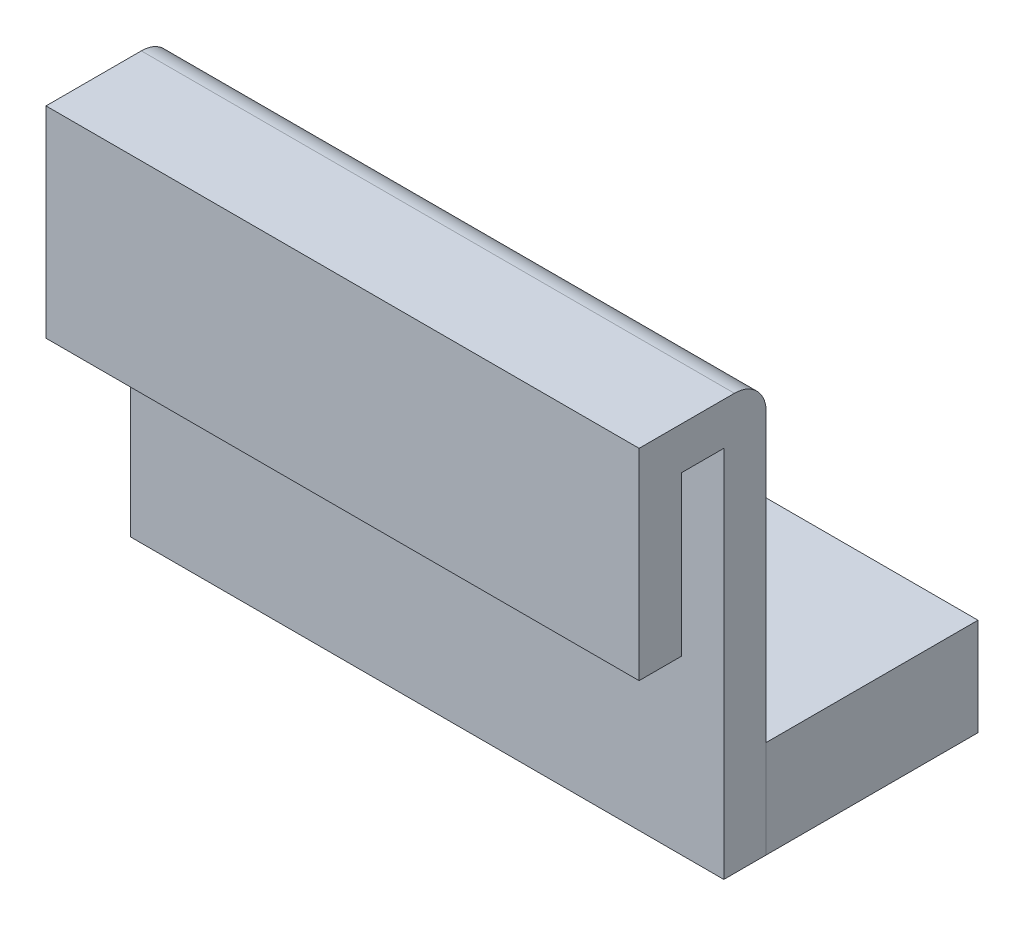
from build123d import *

# Parameters (mm, degrees)
SKETCH1_W               = 560
SKETCH1_H               = 92
BOSS_EXTRUDE1_DEPTH     = 200
SKETCH2_W               = 560
SKETCH2_H               = 352.56
BOSS_EXTRUDE2_DEPTH     = 40
CUT_EXTRUDE1_DEPTH      = 480.56129285
CUT_EXTRUDE1_DEPTH_BACK = 5
SKETCH3_R               = 15
SKETCH4_W               = 560
SKETCH4_H               = 40
BOSS_EXTRUDE3_DEPTH     = 40
SKETCH5_W               = 560
SKETCH5_H               = 40
BOSS_EXTRUDE4_DEPTH     = 40
FILLET1_R               = 30
SKETCH6_W               = 560
SKETCH6_H               = 40
BOSS_EXTRUDE5_DEPTH     = 40
SKETCH7_W               = 560
SKETCH7_H               = 40
BOSS_EXTRUDE6_DEPTH     = 150


with BuildPart() as part:
    # Sketch1 → Boss-Extrude1 (new body)
    with BuildSketch(Plane.XY):
        Rectangle(SKETCH1_W, SKETCH1_H)
    extrude(amount=BOSS_EXTRUDE1_DEPTH)

    # Sketch3 → Cut-Extrude1 (cut, two sides: drawn at the far end of the back side and taken through both)
    with BuildSketch(Plane(origin=(0, 0, 0), x_dir=(-1, 0, 0), z_dir=(0, 0, -1)).offset(-CUT_EXTRUDE1_DEPTH_BACK)):
        with Locations(Location((0, 0, 0), (0, 0, 180))):
            Circle(SKETCH3_R)
    extrude(amount=CUT_EXTRUDE1_DEPTH + CUT_EXTRUDE1_DEPTH_BACK, mode=Mode.SUBTRACT)


with BuildPart() as body_2:
    # Sketch2 → Boss-Extrude2 (new body)
    with BuildSketch(Plane.XY.offset(200)):
        with Locations((0, 130.28)):
            Rectangle(SKETCH2_W, SKETCH2_H)
    extrude(amount=BOSS_EXTRUDE2_DEPTH)

    # Sketch4 → Boss-Extrude3 (add)
    with BuildSketch(Plane(origin=(0, 306.56, 0), x_dir=(1, 0, 0), z_dir=(0, 1, 0))):
        with Locations((0, -220)):
            Rectangle(SKETCH4_W, SKETCH4_H)
    extrude(amount=BOSS_EXTRUDE3_DEPTH)

    # Sketch5 → Boss-Extrude4 (add)
    with BuildSketch(Plane.XY.offset(240)):
        with Locations((0, 326.56)):
            Rectangle(SKETCH5_W, SKETCH5_H)
    extrude(amount=BOSS_EXTRUDE4_DEPTH)

    # Fillet1
    fillet1_edges = [body_2.edges().sort_by_distance(p)[0] for p in [
        (0, 346.56, 200),
    ]]
    fillet(fillet1_edges, radius=FILLET1_R)

    # Sketch6 → Boss-Extrude5 (add)
    with BuildSketch(Plane.XY.offset(280)):
        with Locations((0, 326.56)):
            Rectangle(SKETCH6_W, SKETCH6_H)
    extrude(amount=BOSS_EXTRUDE5_DEPTH)

    # Sketch7 → Boss-Extrude6 (add)
    with BuildSketch(Plane.XZ.offset(-306.56)):
        with Locations((0, 300)):
            Rectangle(SKETCH7_W, SKETCH7_H)
    extrude(amount=BOSS_EXTRUDE6_DEPTH)


solid = Compound([part.part, body_2.part])
